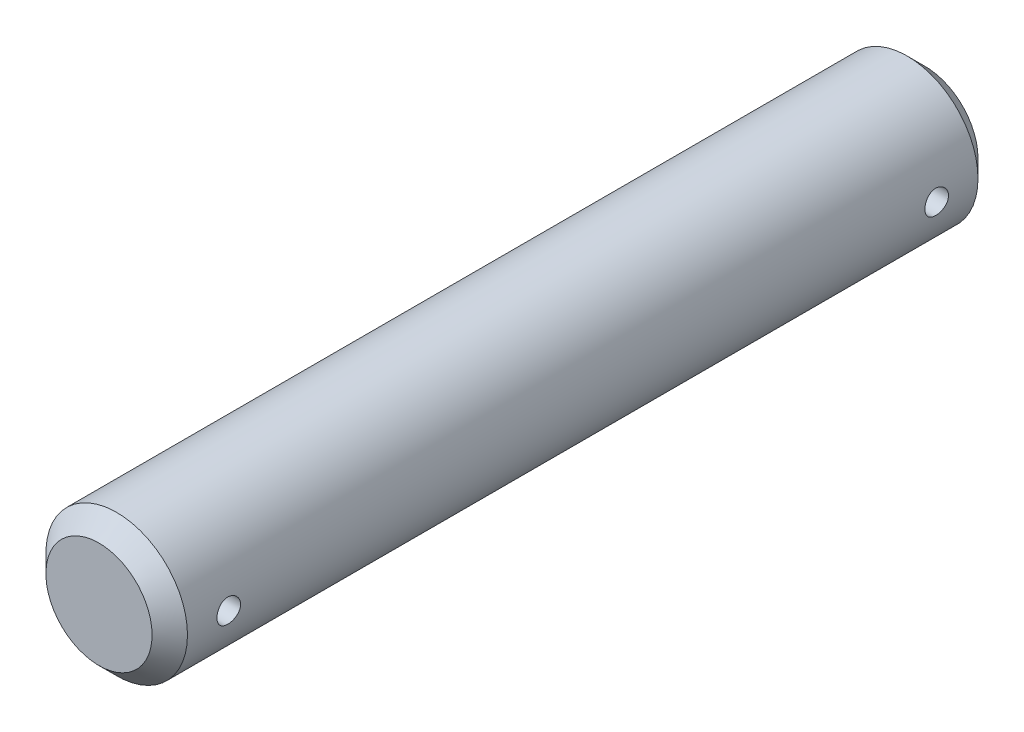
from build123d import *

# Parameters (mm, degrees)
CUT_EXTRUDE1_DEPTH      = 37.013886211
CUT_EXTRUDE1_DEPTH_BACK = 37.013886211
SKETCH2_R               = 1


with BuildPart() as part:
    # Sketch1 → Revolve1 (revolve)
    with BuildSketch(Plane(origin=(0, 0, 0), x_dir=(0, 0, -1), z_dir=(1, 0, 0)), mode=Mode.PRIVATE) as revolve1_sk:
        Polygon((35, 0), (35, 4.5), (33.5, 6), (-33.5, 6), (-35, 4.5), (-35, 0), align=None)
    revolve(revolve1_sk.sketch.rotate(Axis((0, 0, 35), (0, 0, -1)), 90), axis=Axis((0, 0, 35), (0, 0, -1)))

    # Sketch2 → Cut-Extrude1 (cut, two sides: drawn at the far end of the back side and taken through both)
    with BuildSketch(Plane(origin=(0, 0, 0), x_dir=(0, 0, -1), z_dir=(1, 0, 0)).offset(-CUT_EXTRUDE1_DEPTH_BACK)):
        with Locations((30, 0)):
            Circle(SKETCH2_R)
        with Locations((-30, 0)):
            Circle(SKETCH2_R)
    extrude(amount=CUT_EXTRUDE1_DEPTH + CUT_EXTRUDE1_DEPTH_BACK, mode=Mode.SUBTRACT)


solid = part.part
